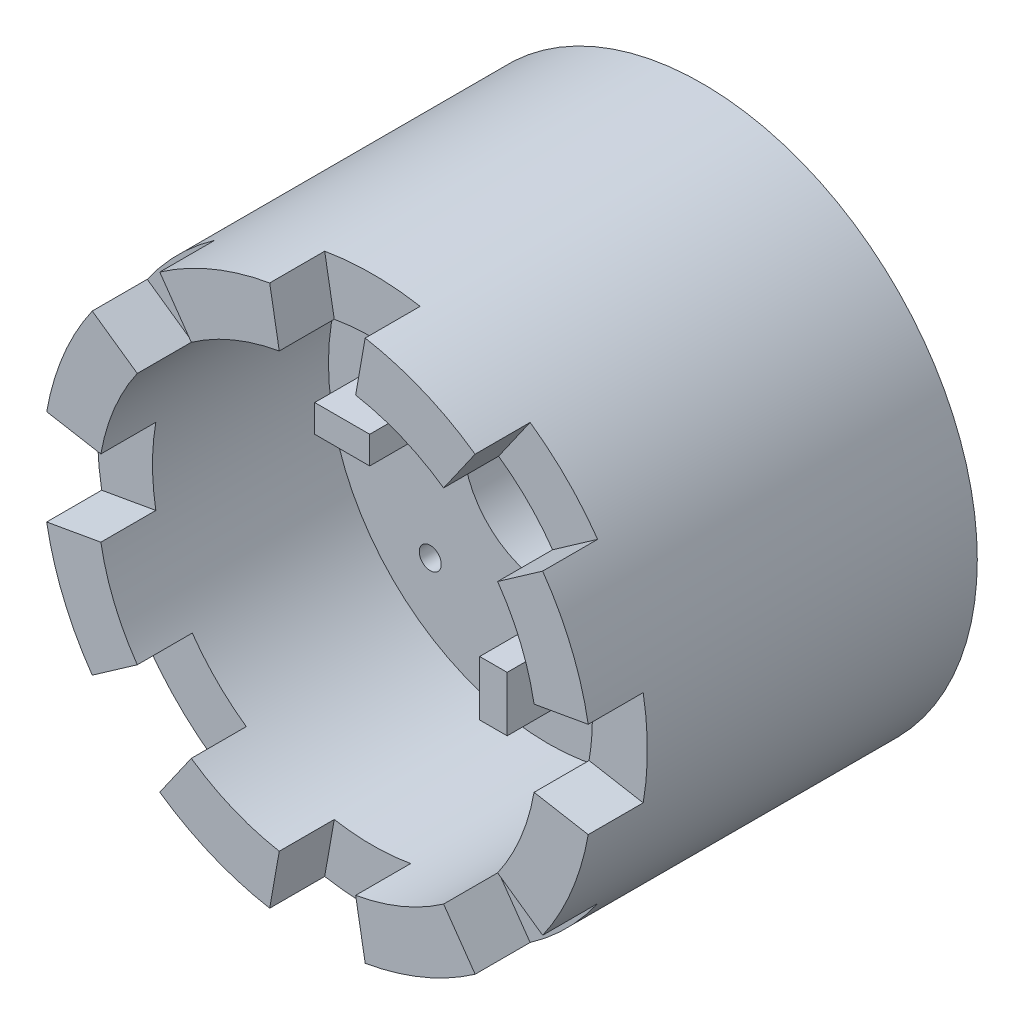
from build123d import *

# Parameters (mm, degrees)
CROQUIS1_R              = 50
CROQUIS1_R_2            = 15.5
SALIENTE_EXTRUIR1_DEPTH = 70
CROQUIS2_R              = 40
CORTAR_EXTRUIR1_DEPTH   = 32
CROQUIS3_R              = 17.5
CORTAR_EXTRUIR2_DEPTH   = 10
CROQUIS4_R              = 40
CROQUIS4_R_2            = 15.5
CORTAR_EXTRUIR3_DEPTH   = 10
CROQUIS5_R              = 2
CORTAR_EXTRUIR4_DEPTH   = 83.24354078
CROQUIS6_R              = 5
CORTAR_EXTRUIR5_DEPTH   = 5
CORTAR_EXTRUIR6_DEPTH   = 10


with BuildPart() as part:
    # Croquis1 → Saliente-Extruir1 (new body)
    with BuildSketch(Plane.XY):
        Circle(CROQUIS1_R)
        Circle(CROQUIS1_R_2, mode=Mode.SUBTRACT)
    extrude(amount=SALIENTE_EXTRUIR1_DEPTH)

    # Croquis2 → Cortar-Extruir1 (cut)
    with BuildSketch(Plane.XY.offset(70)):
        Circle(CROQUIS2_R)
    extrude(amount=-CORTAR_EXTRUIR1_DEPTH, mode=Mode.SUBTRACT)

    # Croquis3 → Cortar-Extruir2 (cut)
    with BuildSketch(Plane(origin=(0, 0, 0), x_dir=(-1, 0, 0), z_dir=(0, 0, -1))):
        Circle(CROQUIS3_R)
    extrude(amount=-CORTAR_EXTRUIR2_DEPTH, mode=Mode.SUBTRACT)

    # Croquis4 → Cortar-Extruir3 (cut)
    # profile 1 of 2: a face of its own
    with BuildSketch(Plane.XY.offset(38)):
        Circle(CROQUIS4_R)
        with BuildLine():
            Line((-2.5, 27.386127875), (-2.5, 32.5))
            Line((-2.5, 32.5), (2.5, 32.5))
            Line((2.5, 32.5), (2.5, 27.386127875))
            ThreePointArc((2.5, 27.386127875), (19.445436483, 19.445436483), (27.386127875, 2.5))
            Line((27.386127875, 2.5), (32.5, 2.5))
            Line((32.5, 2.5), (32.5, -2.5))
            Line((32.5, -2.5), (27.386127875, -2.5))
            ThreePointArc((27.386127875, -2.5), (19.445436483, -19.445436483), (2.5, -27.386127875))
            Line((2.5, -27.386127875), (2.5, -32.5))
            Line((2.5, -32.5), (-2.5, -32.5))
            Line((-2.5, -32.5), (-2.5, -27.386127875))
            ThreePointArc((-2.5, -27.386127875), (-19.445436483, -19.445436483), (-27.386127875, -2.5))
            Line((-27.386127875, -2.5), (-32.5, -2.5))
            Line((-32.5, -2.5), (-32.5, 2.5))
            Line((-32.5, 2.5), (-27.386127875, 2.5))
            ThreePointArc((-27.386127875, 2.5), (-19.445436483, 19.445436483), (-2.5, 27.386127875))
        make_face(mode=Mode.SUBTRACT)
    # profile 2 of 2: a face of its own
    with BuildSketch(Plane.XY.offset(38)):
        with BuildLine():
            Line((-2.5, 22.5), (-2.5, 27.386127875))
            ThreePointArc((-2.5, 27.386127875), (-19.445436483, 19.445436483), (-27.386127875, 2.5))
            Line((-27.386127875, 2.5), (-22.5, 2.5))
            Line((-22.5, 2.5), (-22.5, -2.5))
            Line((-22.5, -2.5), (-27.386127875, -2.5))
            ThreePointArc((-27.386127875, -2.5), (-19.445436483, -19.445436483), (-2.5, -27.386127875))
            Line((-2.5, -27.386127875), (-2.5, -22.5))
            Line((-2.5, -22.5), (2.5, -22.5))
            Line((2.5, -22.5), (2.5, -27.386127875))
            ThreePointArc((2.5, -27.386127875), (19.445436483, -19.445436483), (27.386127875, -2.5))
            Line((27.386127875, -2.5), (22.5, -2.5))
            Line((22.5, -2.5), (22.5, 2.5))
            Line((22.5, 2.5), (27.386127875, 2.5))
            ThreePointArc((27.386127875, 2.5), (19.445436483, 19.445436483), (2.5, 27.386127875))
            Line((2.5, 27.386127875), (2.5, 22.5))
            Line((2.5, 22.5), (-2.5, 22.5))
        make_face()
        with Locations(Location((0, 0, 0), (0, 0, 180))):
            Circle(CROQUIS4_R_2, mode=Mode.SUBTRACT)
    extrude(amount=-CORTAR_EXTRUIR3_DEPTH, mode=Mode.SUBTRACT)

    # Croquis5 → Cortar-Extruir4 (cut, through all)
    with BuildSketch(Plane.XY.offset(28)):
        with Locations((21.486974797, 21.486974797)):
            Circle(CROQUIS5_R)
        with Locations((21.486974797, -21.486974797)):
            Circle(CROQUIS5_R)
        with Locations((-21.486974797, -21.486974797)):
            Circle(CROQUIS5_R)
        with Locations((-21.486974797, 21.486974797)):
            Circle(CROQUIS5_R)
    extrude(amount=-CORTAR_EXTRUIR4_DEPTH, mode=Mode.SUBTRACT)

    # Croquis6 → Cortar-Extruir5 (cut)
    with BuildSketch(Plane(origin=(0, 0, 0), x_dir=(-1, 0, 0), z_dir=(0, 0, -1))):
        with Locations((-21.486974797, 21.486974797)):
            Circle(CROQUIS6_R)
        with Locations((21.486974797, 21.486974797)):
            Circle(CROQUIS6_R)
        with Locations((21.486974797, -21.486974797)):
            Circle(CROQUIS6_R)
        with Locations((-21.486974797, -21.486974797)):
            Circle(CROQUIS6_R)
    extrude(amount=-CORTAR_EXTRUIR5_DEPTH, mode=Mode.SUBTRACT)

    # Croquis7 → Cortar-Extruir6 (cut)
    with BuildSketch(Plane.XY.offset(70)):
        with BuildLine():
            ThreePointArc((-6.945927107, 39.39231012), (-3.48622971, 39.847787924), (0, 40))
            Line((0, 40), (0, 50))
            ThreePointArc((0, 50), (-4.357787137, 49.809734905), (-8.682408883, 49.240387651))
            Line((-8.682408883, 49.240387651), (-6.945927107, 39.39231012))
        make_face()
        with BuildLine():
            Line((0, 50), (0, 40))
            ThreePointArc((0, 40), (3.48622971, 39.847787924), (6.945927107, 39.39231012))
            Line((6.945927107, 39.39231012), (8.682408883, 49.240387651))
            ThreePointArc((8.682408883, 49.240387651), (4.357787137, 49.809734905), (0, 50))
        make_face()
        with BuildLine():
            ThreePointArc((22.943057454, 32.766081772), (28.284271247, 28.284271247), (32.766081772, 22.943057454))
            Line((32.766081772, 22.943057454), (40.957602214, 28.678821818))
            ThreePointArc((40.957602214, 28.678821818), (35.355339059, 35.355339059), (28.678821818, 40.957602214))
            Line((28.678821818, 40.957602214), (22.943057454, 32.766081772))
        make_face()
        with BuildLine():
            ThreePointArc((40, 0), (39.847787924, -3.48622971), (39.39231012, -6.945927107))
            Line((39.39231012, -6.945927107), (49.240387651, -8.682408883))
            ThreePointArc((49.240387651, -8.682408883), (49.809734905, -4.357787137), (50, 0))
            ThreePointArc((50, 0), (49.809734905, 4.357787137), (49.240387651, 8.682408883))
            Line((49.240387651, 8.682408883), (39.39231012, 6.945927107))
            ThreePointArc((39.39231012, 6.945927107), (39.847787924, 3.48622971), (40, 0))
        make_face()
        with BuildLine():
            ThreePointArc((32.766081772, -22.943057454), (28.284271247, -28.284271247), (22.943057454, -32.766081772))
            Line((22.943057454, -32.766081772), (28.678821818, -40.957602214))
            ThreePointArc((28.678821818, -40.957602214), (35.355339059, -35.355339059), (40.957602214, -28.678821818))
            Line((40.957602214, -28.678821818), (32.766081772, -22.943057454))
        make_face()
        with BuildLine():
            ThreePointArc((-32.766081772, 22.943057454), (-28.284271247, 28.284271247), (-22.943057454, 32.766081772))
            Line((-22.943057454, 32.766081772), (-28.678821818, 40.957602214))
            ThreePointArc((-28.678821818, 40.957602214), (-35.355339059, 35.355339059), (-40.957602214, 28.678821818))
            Line((-40.957602214, 28.678821818), (-32.766081772, 22.943057454))
        make_face()
        with BuildLine():
            ThreePointArc((-39.39231012, -6.945927107), (-40, 0), (-39.39231012, 6.945927107))
            Line((-39.39231012, 6.945927107), (-49.240387651, 8.682408883))
            ThreePointArc((-49.240387651, 8.682408883), (-50, 0), (-49.240387651, -8.682408883))
            Line((-49.240387651, -8.682408883), (-39.39231012, -6.945927107))
        make_face()
        with BuildLine():
            ThreePointArc((-22.943057454, -32.766081772), (-28.284271247, -28.284271247), (-32.766081772, -22.943057454))
            Line((-32.766081772, -22.943057454), (-40.957602214, -28.678821818))
            ThreePointArc((-40.957602214, -28.678821818), (-35.355339059, -35.355339059), (-28.678821818, -40.957602214))
            Line((-28.678821818, -40.957602214), (-22.943057454, -32.766081772))
        make_face()
        with BuildLine():
            ThreePointArc((6.945927107, -39.39231012), (0, -40), (-6.945927107, -39.39231012))
            Line((-6.945927107, -39.39231012), (-8.682408883, -49.240387651))
            ThreePointArc((-8.682408883, -49.240387651), (0, -50), (8.682408883, -49.240387651))
            Line((8.682408883, -49.240387651), (6.945927107, -39.39231012))
        make_face()
    extrude(amount=-CORTAR_EXTRUIR6_DEPTH, mode=Mode.SUBTRACT)


solid = part.part
